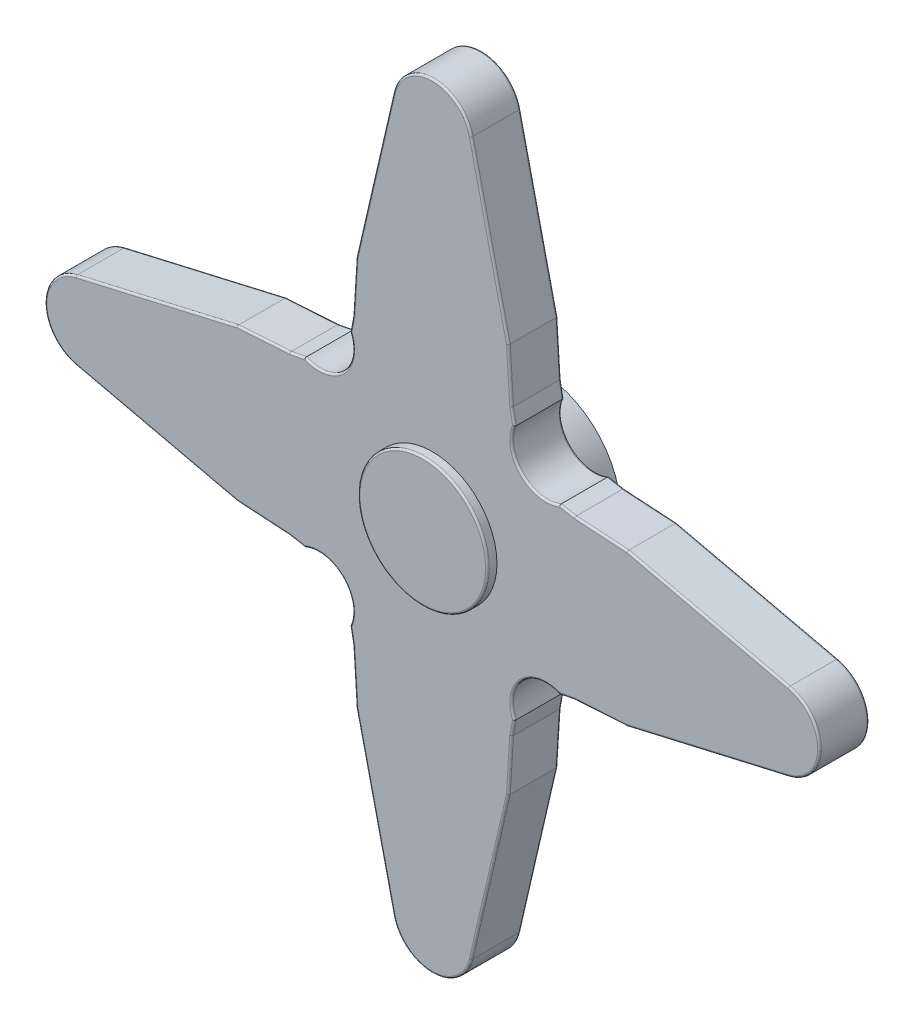
from build123d import *

# Parameters (mm, degrees)
BOSS_EXTRUDE2_DEPTH = 2.6
FILLET1_R           = 0.1
SKETCH2_R           = 3.4
BOSS_EXTRUDE3_DEPTH = 0.5
FILLET2_R           = 0.1
SKETCH3_R           = 4.3
SKETCH3_R_2         = 2.85
BOSS_EXTRUDE4_DEPTH = 3


with BuildPart() as part:
    # Sketch1 → Boss-Extrude2 (new body)
    with BuildSketch(Plane.XY):
        with BuildLine():
            Line((18.721896352261183, 2.0462927046907793), (10.24999999998816, 4.0000000001268905))
            Line((10.24999999998816, 4.0000000001268905), (7.487478615295318, 4.172792206255373))
            Line((7.487478615295318, 4.172792206255373), (6.692839683690129, 4.323085677830108))
            ThreePointArc((6.692839683690129, 4.323085677830108), (6.340574919641972, 4.210766135063346), (5.97279220606129, 4.1727922062638525))
            ThreePointArc((5.97279220606129, 4.1727922062638525), (4.699999999932812, 4.700000000124923), (4.172792206071609, 5.972792206253347))
            ThreePointArc((4.17279220607161, 5.972792206253347), (4.2107661348710455, 6.340574919845243), (4.3230856776418225, 6.692839683903823))
            Line((4.3230856776418225, 6.692839683903823), (4.17279220607161, 7.487478615426204))
            Line((4.17279220607161, 7.487478615426204), (3.9999999999297717, 10.250000000065628))
            Line((3.9999999999297717, 10.250000000065628), (2.0462927044830552, 18.721896352342263))
            ThreePointArc((2.0462927044830543, 18.721896352342263), (-7.511552e-11, 20.350000000065624), (-2.0462927046257122, 18.721896352332745))
            Line((-2.046292704625701, 18.72189635233274), (-4.000000000061814, 10.25000000005972))
            Line((-4.000000000061814, 10.25000000005972), (-4.172792206190295, 7.487478615366877))
            Line((-4.172792206190295, 7.487478615366877), (-4.323085677765031, 6.6928396837616875))
            ThreePointArc((-4.323085677765031, 6.692839683761688), (-4.210766134998268, 6.3405749197135295), (-4.172792206198776, 5.972792206132848))
            ThreePointArc((-4.172792206198776, 5.972792206132848), (-4.700000000059848, 4.700000000004372), (-5.97279220618827, 4.172792206143169))
            ThreePointArc((-5.97279220618827, 4.172792206143168), (-6.340574919780166, 4.210766134942603), (-6.692839683838746, 4.32308567771338))
            Line((-6.692839683838746, 4.32308567771338), (-7.487478615361126, 4.172792206143169))
            Line((-7.487478615361126, 4.172792206143169), (-10.250000000000549, 4.000000000001329))
            Line((-10.250000000000549, 4.000000000001329), (-18.721896352277188, 2.046292704554615))
            ThreePointArc((-18.721896352277188, 2.046292704554615), (-20.350000000000552, -3.55788e-12), (-18.721896352267663, -2.0462927045541535))
            Line((-18.721896352267663, -2.046292704554146), (-10.249999999994643, -3.9999999999902545))
            Line((-10.249999999994643, -3.9999999999902545), (-7.487478615301801, -4.172792206118737))
            Line((-7.487478615301801, -4.172792206118737), (-6.69283968369661, -4.323085677693474))
            ThreePointArc((-6.69283968369661, -4.323085677693474), (-6.340574919648453, -4.210766134926712), (-5.972792206067772, -4.172792206127219))
            ThreePointArc((-5.972792206067772, -4.172792206127216), (-4.6999999999422934, -4.699999999991288), (-4.17279220607809, -5.972792206116711))
            ThreePointArc((-4.17279220607809, -5.972792206116711), (-4.210766134877526, -6.340574919708608), (-4.3230856776483035, -6.692839683767188))
            Line((-4.3230856776483035, -6.692839683767188), (-4.172792206078089, -7.487478615289569))
            Line((-4.172792206078089, -7.487478615289569), (-3.9999999999362505, -10.24999999992899))
            Line((-3.9999999999362505, -10.24999999992899), (-2.046292704489525, -18.721896352205633))
            ThreePointArc((-2.0462927044895256, -18.721896352205633), (6.863898e-11, -20.34999999992897), (2.0462927046192254, -18.721896352196108))
            Line((2.0462927046192214, -18.721896352196104), (4.0000000000553335, -10.249999999923082))
            Line((4.0000000000553335, -10.249999999923082), (4.172792206183815, -7.487478615230241))
            Line((4.172792206183815, -7.487478615230241), (4.32308567775855, -6.692839683625052))
            ThreePointArc((4.32308567775855, -6.692839683625052), (4.210766134991787, -6.340574919576894), (4.172792206192295, -5.972792205996212))
            ThreePointArc((4.172792206192295, -5.972792205996212), (4.700000000053366, -4.699999999867735), (5.972792206181789, -4.172792206006532))
            ThreePointArc((5.972792206181789, -4.17279220600653), (6.340574919773686, -4.210766134805967), (6.692839683832266, -4.323085677576745))
            Line((6.692839683832264, -4.323085677576746), (7.487478615354646, -4.172792206006532))
            Line((7.487478615354646, -4.172792206006532), (10.249999999994067, -3.9999999998646936))
            Line((10.249999999994067, -3.9999999998646936), (18.721896352270708, -2.046292704417977))
            ThreePointArc((18.721896352270708, -2.0462927044179775), (20.349999999994058, 1.4019252e-10), (18.721896352261183, 2.046292704690784))
        make_face()
    extrude(amount=BOSS_EXTRUDE2_DEPTH)

    # Fillet1
    fillet1_edges = [part.edges().sort_by_distance(p)[0] for p in [
        (6.863854e-11, -20.34999999992897, 2.6),
        (3.0231463523372772, -14.485948176059594, 2.6),
        (-7.511575e-11, 20.350000000065624, 2.6),
        (4.086396103119574, -8.86873930757666, 2.6),
        (4.247938941971182, -7.090159149427647, 2.6),
        (4.4667899718396775, -4.98691327320623, 2.6),
        (7.090159149593455, -4.247938941791639, 2.6),
        (8.868739307674357, -4.086396102935613, 2.6),
        (14.485948176132387, -3.0231463521413353, 2.6),
        (20.349999999994058, 1.4019269e-10, 2.6),
        (14.485948176124673, 3.023146352408835, 2.6),
        (-3.0231463523437574, 14.485948176196231, 2.6),
        (8.86873930764174, 4.086396103191132, 2.6),
        (7.090159149492724, 4.24793894204274, 2.6),
        (4.9869132732713055, 4.466789971911235, 2.6),
        (4.247938941856717, 7.090159149665013, 2.6),
        (4.086396103000691, 8.868739307745916, 2.6),
        (-4.086396103126054, 8.868739307713298, 2.6),
        (-4.247938941977663, 7.090159149564283, 2.6),
        (-4.4667899718461594, 4.986913273342866, 2.6),
        (4.086396103000691, 8.868739307745916, 0),
        (4.247938941856717, 7.090159149665013, 0),
        (4.986913273271298, 4.4667899719112345, 0),
        (-7.090159149599936, 4.2479389419282745, 2.6),
        (7.090159149492724, 4.24793894204274, 0),
        (8.86873930764174, 4.086396103191132, 0),
        (14.485948176124673, 3.023146352408835, 0),
        (20.349999999994058, 1.4019269e-10, 0),
        (14.485948176132387, -3.0231463521413353, 0),
        (8.868739307674357, -4.086396102935613, 0),
        (7.090159149593455, -4.247938941791639, 0),
        (4.466789971839679, -4.986913273206239, 0),
        (-8.868739307680837, 4.086396103072248, 2.6),
        (4.247938941971182, -7.090159149427647, 0),
        (4.086396103119574, -8.86873930757666, 0),
        (3.0231463523372772, -14.485948176059594, 0),
        (6.863854e-11, -20.34999999992897, 0),
        (-3.023146352212888, -14.48594817606731, 0),
        (-4.08639610300717, -8.86873930760928, 0),
        (-4.247938941863197, -7.090159149528379, 0),
        (-4.466789971722267, -4.986913273338999, 0),
        (-7.090159149499206, -4.247938941906105, 0),
        (-8.868739307648221, -4.086396103054495, 0),
        (-14.48594817613887, 3.023146352277972, 2.6),
        (-14.485948176131153, -3.0231463522722004, 0),
        (-20.350000000000552, -3.55899e-12, 0),
        (-14.48594817613887, 3.023146352277972, 0),
        (-8.868739307680837, 4.086396103072248, 0),
        (-7.090159149599936, 4.2479389419282745, 0),
        (-4.4667899718461594, 4.986913273342869, 0),
        (-4.247938941977663, 7.090159149564283, 0),
        (-4.086396103126054, 8.868739307713298, 0),
        (-3.0231463523437574, 14.485948176196231, 0),
        (-7.511575e-11, 20.350000000065624, 0),
        (3.0231463522064135, 14.485948176203944, 0),
        (-20.350000000000552, -3.55899e-12, 2.6),
        (3.0231463522064135, 14.485948176203944, 2.6),
        (-14.485948176131153, -3.0231463522722004, 2.6),
        (-8.868739307648221, -4.086396103054495, 2.6),
        (-7.090159149499206, -4.247938941906105, 2.6),
        (-4.466789971722268, -4.9869132733390025, 2.6),
        (-4.247938941863197, -7.090159149528379, 2.6),
        (-4.08639610300717, -8.86873930760928, 2.6),
        (-3.023146352212888, -14.48594817606731, 2.6),
    ]]
    fillet(fillet1_edges, radius=FILLET1_R)

    # Sketch2 → Boss-Extrude3 (add)
    with BuildSketch(Plane.XY.offset(2.6)):
        Circle(SKETCH2_R)
    extrude(amount=BOSS_EXTRUDE3_DEPTH)

    # Fillet2
    fillet2_edges = [part.edges().sort_by_distance(p)[0] for p in [
        (-3.4, 4.2e-16, 3.1),
    ]]
    fillet(fillet2_edges, radius=FILLET2_R)

    # Sketch3 → Boss-Extrude4 (add)
    with BuildSketch(Plane(origin=(0, 0, 0), x_dir=(-1, 0, 0), z_dir=(0, 0, -1))):
        with Locations(Location((0, 0, 0), (0, 0, 180))):
            Circle(SKETCH3_R)
        Circle(SKETCH3_R_2, mode=Mode.SUBTRACT)
    extrude(amount=BOSS_EXTRUDE4_DEPTH)


solid = part.part
